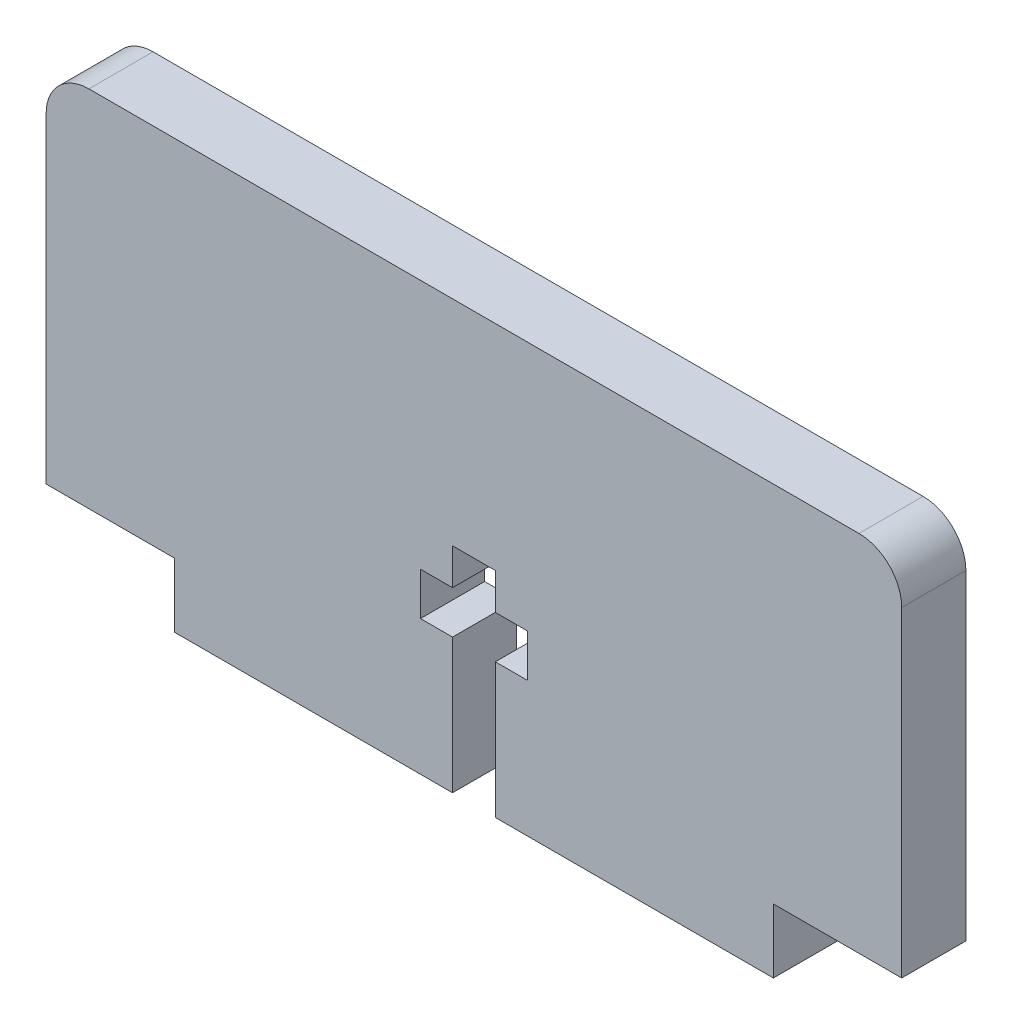
from build123d import *

# Parameters (mm, degrees)
BOSS_EXTRU_1_DEPTH      = 15
ESQUISSE3_W             = 30
ESQUISSE3_H             = 15
ENL_V_MAT_EXTRU_1_DEPTH = 15


with BuildPart() as part:
    # Esquisse2 → Boss.-Extru.1 (new body)
    with BuildSketch(Plane.XY):
        with BuildLine():
            Line((-100, 0), (100, 0))
            Line((100, 0), (100, 15))
            Line((100, 15), (100, 55.414518843))
            Line((100, 55.414518843), (100, 75.414518843))
            Line((100, 75.414518843), (100, 90))
            ThreePointArc((100, 90), (97.071067812, 97.071067812), (90, 100))
            Line((90, 100), (-90, 100))
            ThreePointArc((-90, 100), (-97.071067812, 97.071067812), (-100, 90))
            Line((-100, 90), (-100, 75.414518843))
            Line((-100, 75.414518843), (-100, 55.414518843))
            Line((-100, 55.414518843), (-100, 15))
            Line((-100, 15), (-100, 0))
        make_face()
    extrude(amount=BOSS_EXTRU_1_DEPTH)

    # Esquisse3 → Enlèv. mat.-Extru.1 (cut)
    with BuildSketch(Plane.XY.offset(15)):
        with Locations((-85, 7.5)):
            Rectangle(ESQUISSE3_W, ESQUISSE3_H)
        Polygon((-5, 31.515847226), (-5, 0), (5, 0), (5, 31.515847226), (12.5, 31.515847226), (12.5, 41.515847226), (5, 41.515847226), (5, 50), (-5, 50), (-5, 41.515847226), (-12.5, 41.515847226), (-12.5, 31.515847226), align=None)
        with Locations((85, 7.5)):
            Rectangle(ESQUISSE3_W, ESQUISSE3_H)
    extrude(amount=-ENL_V_MAT_EXTRU_1_DEPTH, mode=Mode.SUBTRACT)


solid = part.part
